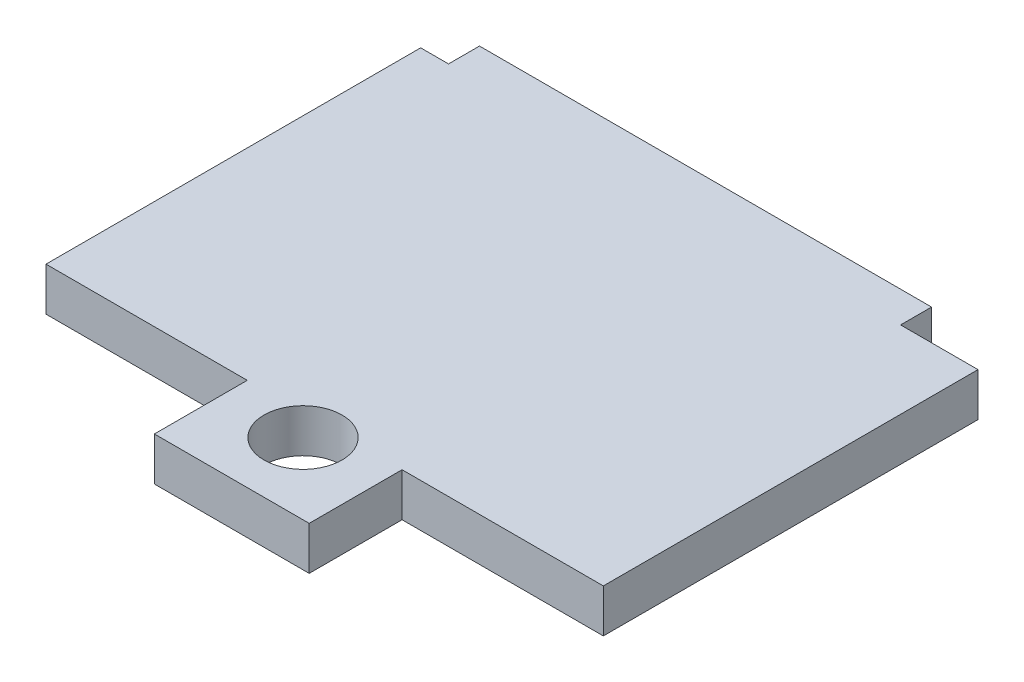
from build123d import *

# Parameters (mm, degrees)
BOSS_EXTRUDE1_DEPTH  = 1.778
M3_CLEARANCE_HOLE1_D = 3.2
SKETCH4_W            = 2.54
SKETCH4_H            = 9.144
BOSS_EXTRUDE2_DEPTH  = 0.889
CUT_EXTRUDE1_DEPTH   = 0.508


with BuildPart() as part:
    # Sketch1 → Boss-Extrude1 (new body)
    with BuildSketch(Plane(origin=(0, 0, 0), x_dir=(1, 0, 0), z_dir=(0, 1, 0))):
        Polygon((0, 15.367), (0, 0), (8.255, 0), (8.255, -3.81), (14.605, -3.81), (14.605, 0), (22.86, 0), (22.86, 15.367), (19.685, 15.367), (19.685, 16.637), (1.143, 16.637), (1.143, 15.367), align=None)
    extrude(amount=BOSS_EXTRUDE1_DEPTH)

    # M3 Clearance Hole1 (through all)
    with Locations(Plane(origin=(0, 1.778, 0), x_dir=(1, 0, 0), z_dir=(0, 1, 0))):
        with Locations((11.43, -0.888075369)):
            Hole(M3_CLEARANCE_HOLE1_D / 2)

    # Sketch4 → Boss-Extrude2 (add)
    with BuildSketch(Plane.XZ):
        with Locations((16.51, -8.874849992)):
            Rectangle(SKETCH4_W, SKETCH4_H)
        with Locations((1.27, -8.874849992)):
            Rectangle(SKETCH4_W, SKETCH4_H)
    extrude(amount=BOSS_EXTRUDE2_DEPTH)

    # Sketch5 → Cut-Extrude1 (cut)
    with BuildSketch(Plane.XZ):
        with BuildLine():
            Line((7.109318667, -7.585594965), (6.678829885, -7.585594965))
            add(Edge.make_bspline(
                [(6.678829885, -7.585594965), (6.687606413, -7.546881939), (6.704786318, -7.471101851), (6.739514735, -7.362847211), (6.778645599, -7.261607651), (6.823854188, -7.16815687), (6.876241689, -7.083223527), (6.932953507, -7.005168513), (6.996425177, -6.935619603), (7.06526306, -6.873614705), (7.139119628, -6.820051603), (7.215809346, -6.772535436), (7.295943015, -6.73269633), (7.379016346, -6.699317151), (7.465456038, -6.674052482), (7.555190339, -6.656987654), (7.647692314, -6.644999861), (7.710608233, -6.643862539), (7.742431647, -6.643287272)],
                knots=[0, 0, 0, 0, 1.225194122, 2.398296627, 3.506547767, 4.574817873, 5.598350885, 6.584148364, 7.54966307, 8.500147383, 9.439776218, 10.36307994, 11.282851771, 12.199447467, 13.124300948, 14.058371117, 15.017907346, 16, 16, 16, 16], degree=3))
            add(Edge.make_bspline(
                [(7.742431647, -6.643287272), (7.791838064, -6.64495105), (7.889631568, -6.648244278), (8.033694558, -6.67312847), (8.172100008, -6.715843061), (8.303560266, -6.77358421), (8.425043105, -6.844283173), (8.532485794, -6.926762811), (8.624888411, -7.01897304), (8.699579914, -7.121022921), (8.758726357, -7.228107635), (8.800985868, -7.338038976), (8.82785946, -7.449693977), (8.831072595, -7.52491871), (8.832676038, -7.562457945)],
                knots=[0, 0, 0, 0, 1.126551995, 2.229861531, 3.322496069, 4.422827045, 5.497949776, 6.520418829, 7.504194933, 8.464779191, 9.395175895, 10.286118409, 11.144725379, 12, 12, 12, 12], degree=3))
            add(Edge.make_bspline(
                [(8.832676038, -7.562457945), (8.831529311, -7.598770918), (8.829285971, -7.669809853), (8.809779696, -7.773079154), (8.778414584, -7.869955852), (8.733546283, -7.960037799), (8.676366259, -8.043505374), (8.605820101, -8.11963771), (8.523300865, -8.189822201), (8.460912451, -8.229271123), (8.428829885, -8.249557304)],
                knots=[0, 0, 0, 0, 1.039530957, 2.033630564, 2.999111873, 3.948297759, 4.906578666, 5.887513816, 6.913676835, 8, 8, 8, 8], degree=3))
            add(Edge.make_bspline(
                [(8.428829885, -8.249557304), (8.463496396, -8.264410255), (8.532668676, -8.294047286), (8.626821509, -8.357230481), (8.713373956, -8.432635284), (8.76177295, -8.492520632), (8.786402, -8.522994804)],
                knots=[0, 0, 0, 0, 0.990740455, 1.976887035, 2.970487876, 4, 4, 4, 4], degree=3))
            add(Edge.make_bspline(
                [(8.786402, -8.522994804), (8.804248592, -8.547780308), (8.839498842, -8.596736165), (8.886260255, -8.673200066), (8.924270516, -8.752049266), (8.957300276, -8.831294363), (8.981692536, -8.912418058), (8.999268929, -8.994711786), (9.010167012, -9.078458248), (9.011495681, -9.134808234), (9.012163218, -9.163119003)],
                knots=[0, 0, 0, 0, 1.060434252, 2.094549648, 3.107169572, 4.097295716, 5.072846837, 6.043796276, 7.017184609, 8, 8, 8, 8], degree=3))
            add(Edge.make_bspline(
                [(9.012163218, -9.163119003), (9.010402174, -9.211902641), (9.006869964, -9.309750295), (8.973939705, -9.454630235), (8.923513742, -9.597349712), (8.864479466, -9.711736422), (8.808898341, -9.800434348), (8.76202592, -9.863740322), (8.711565884, -9.923828717), (8.656191874, -9.979274691), (8.597662448, -10.032071771), (8.534106656, -10.080445311), (8.466646348, -10.125361344), (8.395607488, -10.166659892), (8.320901712, -10.202925007), (8.244149419, -10.235539953), (8.164424194, -10.261694227), (8.083214676, -10.284737998), (7.999166659, -10.301027709), (7.913153025, -10.31411631), (7.82456716, -10.320794586), (7.764876224, -10.322109921), (7.734719308, -10.322774452)],
                knots=[0, 0, 0, 0, 1.521749033, 3.052244174, 4.617626532, 6.240122497, 7.060311358, 7.885196768, 8.698339091, 9.508724546, 10.330730427, 11.158549718, 12.000758621, 12.860902525, 13.722748307, 14.593084173, 15.463328201, 16.341708233, 17.227848997, 18.135261118, 19.057900949, 20, 20, 20, 20], degree=3))
            add(Edge.make_bspline(
                [(7.734719308, -10.322774452), (7.696595886, -10.321923388), (7.62156272, -10.320248355), (7.511549348, -10.308347334), (7.40621469, -10.288012596), (7.305895619, -10.259134389), (7.209938226, -10.222831767), (7.119287227, -10.177602294), (7.033199122, -10.124874895), (6.952103954, -10.06369912), (6.877102368, -9.993491169), (6.808294214, -9.914361119), (6.747522371, -9.825257941), (6.692588243, -9.727548526), (6.644993726, -9.620117202), (6.603937977, -9.503828687), (6.569119199, -9.378303391), (6.552678791, -9.290867476), (6.5442145, -9.245851375)],
                knots=[0, 0, 0, 0, 1.031951552, 2.031050468, 2.99141865, 3.932589319, 4.853771667, 5.764839348, 6.670884665, 7.583203617, 8.509779947, 9.447179227, 10.415909331, 11.424319639, 12.477825485, 13.592421652, 14.760465984, 16, 16, 16, 16], degree=3))
            Line((6.5442145, -9.245851375), (6.979611135, -9.245851375))
            add(Edge.make_bspline(
                [(6.979611135, -9.245851375), (6.988289213, -9.27559327), (7.004916754, -9.332579913), (7.03217547, -9.41396699), (7.061499109, -9.487102783), (7.091713821, -9.552969685), (7.122971628, -9.611302517), (7.155949951, -9.662007173), (7.189971175, -9.70555776), (7.215585064, -9.729444424), (7.22780825, -9.740843362)],
                knots=[0, 0, 0, 0, 1.326285875, 2.54121601, 3.672658499, 4.697761427, 5.642367002, 6.502616728, 7.285434817, 8, 8, 8, 8], degree=3))
            add(Edge.make_bspline(
                [(7.22780825, -9.740843362), (7.245501627, -9.755286108), (7.280544315, -9.783890745), (7.338250074, -9.819261741), (7.397758192, -9.850926818), (7.461194498, -9.874753926), (7.526634157, -9.894893568), (7.595188977, -9.908781793), (7.666490626, -9.917352458), (7.715063426, -9.918399034), (7.73962716, -9.918928298)],
                knots=[0, 0, 0, 0, 0.989076215, 1.958918776, 2.928708407, 3.907140108, 4.891221483, 5.894723991, 6.935341563, 8, 8, 8, 8], degree=3))
            add(Edge.make_bspline(
                [(7.73962716, -9.918928298), (7.77003276, -9.918210468), (7.829603323, -9.916804097), (7.916460177, -9.907142013), (7.998818219, -9.890145903), (8.076315281, -9.866517438), (8.149464938, -9.836171463), (8.21750118, -9.798865615), (8.281230294, -9.755283167), (8.339083778, -9.704710555), (8.390918388, -9.64982439), (8.437141369, -9.592558497), (8.476640261, -9.533194815), (8.508283205, -9.470969195), (8.533215012, -9.406648171), (8.550476603, -9.340052972), (8.561541927, -9.271226734), (8.562804547, -9.224626863), (8.563445269, -9.20097958)],
                knots=[0, 0, 0, 0, 1.196856166, 2.344877135, 3.434653565, 4.502660904, 5.529498559, 6.546397239, 7.551828815, 8.562675341, 9.564818567, 10.520268272, 11.456705045, 12.365995596, 13.262962725, 14.166698094, 15.069683942, 16, 16, 16, 16], degree=3))
            add(Edge.make_bspline(
                [(8.563445269, -9.20097958), (8.562050698, -9.169786181), (8.559263438, -9.107441496), (8.538107993, -9.015767262), (8.504177677, -8.92686127), (8.456248424, -8.842804287), (8.397910372, -8.764057964), (8.327937994, -8.695081393), (8.248158636, -8.636148124), (8.173743658, -8.595403593), (8.106315969, -8.568477599), (8.047518725, -8.549742582), (7.980748311, -8.533101983), (7.906316995, -8.518523653), (7.823973932, -8.505980796), (7.733692545, -8.495626324), (7.635235844, -8.487365154), (7.566926626, -8.483130336), (7.531393987, -8.480927497)],
                knots=[0, 0, 0, 0, 1.058801672, 2.116173898, 3.179133807, 4.280986043, 5.392377071, 6.498225676, 7.604871823, 8.752253925, 9.368447799, 10.068883315, 10.846735517, 11.704571958, 12.644304815, 13.675272135, 14.790738352, 16, 16, 16, 16], degree=3))
            Line((7.531393987, -8.480927497), (7.531393987, -8.079184708))
            add(Edge.make_bspline(
                [(7.531393987, -8.079184708), (7.577711616, -8.078332506), (7.666627521, -8.076696533), (7.794279974, -8.06182744), (7.910456047, -8.037886459), (8.014591817, -8.003680759), (8.105426822, -7.961346062), (8.184221997, -7.915921332), (8.248571095, -7.864119902), (8.299259809, -7.807623936), (8.33651952, -7.746744375), (8.364765509, -7.684357769), (8.380409468, -7.618365571), (8.382768055, -7.573750634), (8.38395809, -7.551239997)],
                knots=[0, 0, 0, 0, 1.49683591, 2.87347434, 4.147795521, 5.325633569, 6.407353164, 7.383009189, 8.25851615, 9.066624807, 9.823413814, 10.557538392, 11.272200497, 12, 12, 12, 12], degree=3))
            add(Edge.make_bspline(
                [(8.38395809, -7.551239997), (8.383447895, -7.534607449), (8.382442298, -7.501824607), (8.373517307, -7.453374902), (8.359690136, -7.406483044), (8.339915378, -7.361240684), (8.314011598, -7.318056703), (8.283391513, -7.275947281), (8.246382071, -7.235875521), (8.204609086, -7.197688597), (8.1588905, -7.16213395), (8.109425991, -7.130963245), (8.0567189, -7.10507023), (8.000765238, -7.084020159), (7.941954436, -7.067123537), (7.879778375, -7.055271591), (7.81458294, -7.048139605), (7.770027532, -7.047472912), (7.7473395, -7.047133426)],
                knots=[0, 0, 0, 0, 0.88508993, 1.744517034, 2.61478088, 3.484243336, 4.365825862, 5.291885516, 6.252189795, 7.265246754, 8.303377192, 9.332440159, 10.373327524, 11.425096702, 12.51242353, 13.62794981, 14.792129802, 16, 16, 16, 16], degree=3))
            add(Edge.make_bspline(
                [(7.7473395, -7.047133426), (7.714761738, -7.048542777), (7.651097199, -7.051296978), (7.558567878, -7.071077036), (7.472662379, -7.105499897), (7.405677482, -7.144723065), (7.355353688, -7.184495293), (7.318400091, -7.221837243), (7.282482723, -7.266195893), (7.245866952, -7.316402044), (7.210753738, -7.374094323), (7.176039942, -7.438275141), (7.141458771, -7.509315291), (7.120294486, -7.559545518), (7.109318667, -7.585594965)],
                knots=[0, 0, 0, 0, 1.30644707, 2.553102055, 3.773430717, 5.004978473, 5.652102429, 6.34150733, 7.107309491, 7.939915375, 8.832283585, 9.813897121, 10.866284818, 12, 12, 12, 12], degree=3))
        make_face()
        with BuildLine():
            Line((11.569855526, -6.733030862), (11.569855526, -7.136877016))
            Line((11.569855526, -7.136877016), (10.420015782, -7.136877016))
            Line((10.420015782, -7.136877016), (10.232115141, -7.966304099))
            add(Edge.make_bspline(
                [(10.232115141, -7.966304099), (10.254036105, -7.955739686), (10.299149625, -7.93399804), (10.374572576, -7.915054443), (10.456460419, -7.901725747), (10.513668346, -7.900391343), (10.543413218, -7.899697529)],
                knots=[0, 0, 0, 0, 0.906577793, 1.865744317, 2.890308309, 4, 4, 4, 4], degree=3))
            add(Edge.make_bspline(
                [(10.543413218, -7.899697529), (10.585541027, -7.900468848), (10.668251938, -7.901983206), (10.788796463, -7.918905589), (10.903663955, -7.944257585), (11.011909464, -7.982078055), (11.114769124, -8.028636846), (11.211127019, -8.086898409), (11.300883072, -8.155874436), (11.383917229, -8.234390446), (11.4595956, -8.319913216), (11.52459305, -8.412269496), (11.580934764, -8.508761247), (11.625594212, -8.611055941), (11.660879801, -8.718095447), (11.685974024, -8.830327131), (11.701927122, -8.947414718), (11.70361524, -9.027282987), (11.70447091, -9.067766439)],
                knots=[0, 0, 0, 0, 1.094894284, 2.149641875, 3.159658044, 4.149576056, 5.125966368, 6.091225838, 7.071072142, 8.064343292, 9.05924964, 10.03573454, 10.996966885, 11.96032995, 12.932910184, 13.923798045, 14.947619342, 16, 16, 16, 16], degree=3))
            add(Edge.make_bspline(
                [(11.70447091, -9.067766439), (11.703812921, -9.096055337), (11.702511309, -9.152015528), (11.695728744, -9.235224708), (11.682782075, -9.316639023), (11.665592325, -9.396887317), (11.641906203, -9.475281638), (11.614942562, -9.552864205), (11.581815578, -9.628398205), (11.543995796, -9.701852144), (11.502035051, -9.772688463), (11.455834325, -9.840047858), (11.40528806, -9.9033918), (11.350216901, -9.962190109), (11.292126205, -10.017955026), (11.229500632, -10.069231134), (11.162518144, -10.116233804), (11.092134187, -10.159476841), (11.018382406, -10.19854364), (10.940829355, -10.230890157), (10.861400339, -10.260279899), (10.778130906, -10.282286017), (10.692591142, -10.300803286), (10.603754484, -10.313091932), (10.512243654, -10.321103846), (10.450181556, -10.322211196), (10.418613538, -10.322774452)],
                knots=[0, 0, 0, 0, 1.012275937, 2.002451767, 2.98397589, 3.959820946, 4.936095762, 5.911940818, 6.896771482, 7.884012822, 8.866284557, 9.840372785, 10.804070441, 11.762530572, 12.720625922, 13.68308951, 14.655094125, 15.646011038, 16.637104318, 17.63729087, 18.650257215, 19.66446511, 20.715636712, 21.77986274, 22.870722459, 24, 24, 24, 24], degree=3))
            add(Edge.make_bspline(
                [(10.418613538, -10.322774452), (10.383058652, -10.321920857), (10.312916212, -10.32023689), (10.209897653, -10.308292904), (10.111068248, -10.288027493), (10.016846784, -10.259017797), (9.926532249, -10.222631574), (9.840894628, -10.177619712), (9.759601135, -10.124386188), (9.682547083, -10.063945844), (9.612270748, -9.994999517), (9.54749145, -9.920776571), (9.492298953, -9.83854431), (9.44374629, -9.750572046), (9.402028848, -9.656144264), (9.368840511, -9.555081928), (9.34230253, -9.447767765), (9.331695585, -9.373574995), (9.326265782, -9.335594965)],
                knots=[0, 0, 0, 0, 1.049569621, 2.070583864, 3.057046508, 4.023914414, 4.977170942, 5.927726879, 6.875021894, 7.842677272, 8.813672282, 9.777581439, 10.74592533, 11.731059957, 12.74126976, 13.788569057, 14.867946107, 16, 16, 16, 16], degree=3))
            Line((9.326265782, -9.335594965), (9.764466904, -9.335594965))
            add(Edge.make_bspline(
                [(9.764466904, -9.335594965), (9.772806842, -9.372274525), (9.788462862, -9.441130657), (9.822096515, -9.534951812), (9.858144405, -9.614747471), (9.902234225, -9.680006466), (9.952838157, -9.733574034), (10.009004916, -9.780072221), (10.070711069, -9.821782133), (10.138643199, -9.856404914), (10.210217237, -9.884454946), (10.284585081, -9.904031993), (10.360244845, -9.91634193), (10.411322924, -9.918066609), (10.436842705, -9.918928298)],
                knots=[0, 0, 0, 0, 1.385459112, 2.600831482, 3.66841355, 4.605180919, 5.48910649, 6.376050311, 7.288896949, 8.229144678, 9.181161654, 10.117453426, 11.059436513, 12, 12, 12, 12], degree=3))
            add(Edge.make_bspline(
                [(10.436842705, -9.918928298), (10.464449337, -9.918001483), (10.518953438, -9.916171662), (10.599246801, -9.905217379), (10.676037091, -9.884954884), (10.750433014, -9.858691028), (10.821135104, -9.822918564), (10.889878802, -9.781149623), (10.95415742, -9.729858535), (11.015767458, -9.672828882), (11.07219605, -9.609659549), (11.12133136, -9.541407876), (11.163245919, -9.469444381), (11.196648211, -9.393290414), (11.223757056, -9.313643782), (11.242390571, -9.229960478), (11.254015974, -9.142415311), (11.255166348, -9.082761292), (11.255752961, -9.052341759)],
                knots=[0, 0, 0, 0, 0.99750234, 1.969380735, 2.919490565, 3.862219911, 4.813679117, 5.776605688, 6.762898166, 7.778387729, 8.806918829, 9.816812977, 10.811632172, 11.809420289, 12.815921014, 13.846113939, 14.901663155, 16, 16, 16, 16], degree=3))
            add(Edge.make_bspline(
                [(11.255752961, -9.052341759), (11.255055461, -9.025200601), (11.253685862, -8.971906686), (11.243653274, -8.894015795), (11.227739568, -8.819717511), (11.20461559, -8.749710287), (11.174890584, -8.683606752), (11.13833803, -8.621829782), (11.095069327, -8.564035356), (11.046409359, -8.51003618), (10.991325212, -8.461787561), (10.932181032, -8.418605937), (10.867180902, -8.38368175), (10.79866899, -8.353795683), (10.725060543, -8.331953827), (10.647674157, -8.31435425), (10.565099926, -8.305898605), (10.508604302, -8.304342345), (10.479611135, -8.303543683)],
                knots=[0, 0, 0, 0, 1.071512717, 2.104004018, 3.095982969, 4.067795438, 5.009520676, 5.952827242, 6.895998369, 7.856350385, 8.817411605, 9.782937659, 10.74115891, 11.725120868, 12.729302161, 13.768330494, 14.854722481, 16, 16, 16, 16], degree=3))
            add(Edge.make_bspline(
                [(10.479611135, -8.303543683), (10.454817995, -8.304138684), (10.40276735, -8.305387829), (10.321317347, -8.314420067), (10.232683589, -8.328626512), (10.13700623, -8.348274805), (10.03419333, -8.373872556), (9.924119954, -8.404890752), (9.806664306, -8.441085317), (9.72652704, -8.46876845), (9.685240141, -8.483030862)],
                knots=[0, 0, 0, 0, 0.727614075, 1.527550888, 2.402655696, 3.361819828, 4.39328773, 5.511706796, 6.718025739, 8, 8, 8, 8], degree=3))
            Line((9.685240141, -8.483030862), (10.052627961, -6.733030862))
            Line((10.052627961, -6.733030862), (11.569855526, -6.733030862))
        make_face()
    extrude(amount=-CUT_EXTRUDE1_DEPTH, mode=Mode.SUBTRACT)


solid = part.part
